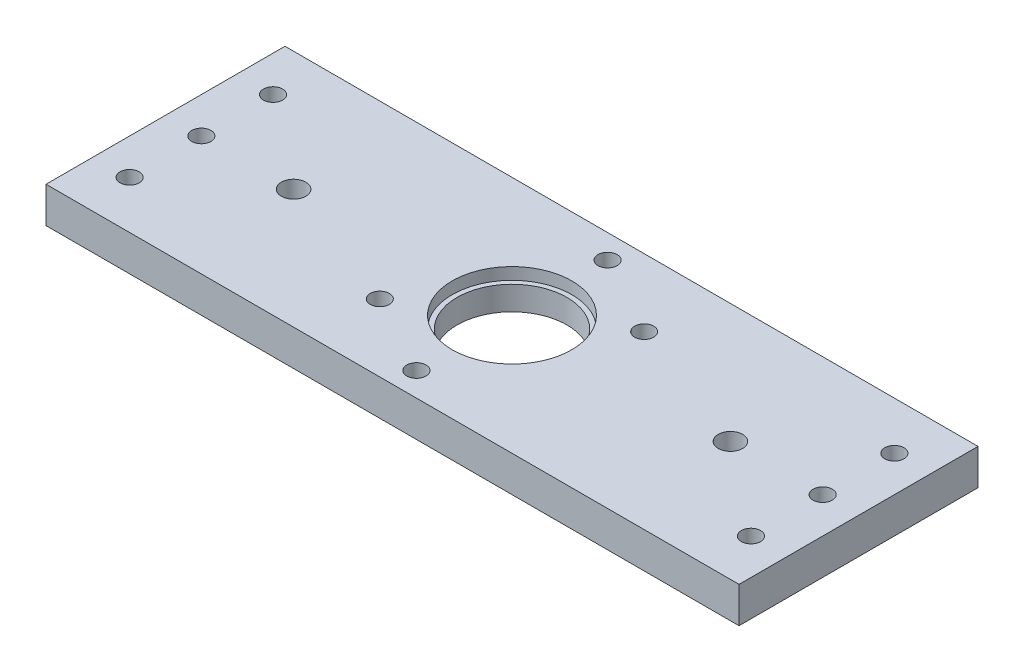
from build123d import *

# Parameters (mm, degrees)
SKETCH1_W                  = 184.15
SKETCH1_H                  = 63.5
BOSS_EXTRUDE1_DEPTH        = 9.525
SKETCH3_R                  = 14.605
CUT_EXTRUDE1_DEPTH         = 98.860072297
F_10_CLEARANCE_HOLE1_D     = 5.1054
F_6_5_6_5_DIAMETER_HOLE3_D = 6.5
SKETCH29_R                 = 15.875
CUT_EXTRUDE5_DEPTH         = 3.175
F_10_CLEARANCE_HOLE2_D     = 5.1054
SKETCH36_R                 = 2.54
CUT_EXTRUDE6_DEPTH         = 98.860072297


with BuildPart() as part:
    # Sketch1 → Boss-Extrude1 (new body)
    with BuildSketch(Plane(origin=(0, 0, 0), x_dir=(1, 0, 0), z_dir=(0, 1, 0))):
        Rectangle(SKETCH1_W, SKETCH1_H)
    extrude(amount=BOSS_EXTRUDE1_DEPTH)

    # Sketch3 → Cut-Extrude1 (cut, through all)
    with BuildSketch(Plane(origin=(0, 9.525, 0), x_dir=(1, 0, 0), z_dir=(0, 1, 0))):
        with Locations(Location((0, 0, 0), (0, 0, 270))):
            Circle(SKETCH3_R)
    extrude(amount=-CUT_EXTRUDE1_DEPTH, mode=Mode.SUBTRACT)

    # #10 Clearance Hole1 (through all)
    with Locations(Plane(origin=(0, 0, 0), x_dir=(-1, 0, 0), z_dir=(0, -1, 0))):
        with Locations((0, -25.4), (0, 25.4)):
            Hole(F_10_CLEARANCE_HOLE1_D / 2)

    # Ø6.5 (6.5) Diameter Hole3 (through all)
    with Locations(Plane(origin=(0, 0, 0), x_dir=(-1, 0, 0), z_dir=(0, -1, 0))):
        with Locations((58.039, 0), (-58.039, 0)):
            Hole(F_6_5_6_5_DIAMETER_HOLE3_D / 2)

    # Sketch29 → Cut-Extrude5 (cut)
    with BuildSketch(Plane(origin=(0, 9.525, 0), x_dir=(1, 0, 0), z_dir=(0, 1, 0))):
        with Locations(Location((0, 0, 0), (0, 0, 270))):
            Circle(SKETCH29_R)
    extrude(amount=-CUT_EXTRUDE5_DEPTH, mode=Mode.SUBTRACT)

    # #10 Clearance Hole2 (through all)
    with Locations(Plane(origin=(0, 9.525, 0), x_dir=(1, 0, 0), z_dir=(0, 1, 0))):
        with Locations((-82.55, 19.05), (-82.55, -19.05), (82.55, -19.05), (82.55, 19.05), (-82.55, 0), (82.55, 0)):
            Hole(F_10_CLEARANCE_HOLE2_D / 2)

    # Sketch36 → Cut-Extrude6 (cut, through all)
    with BuildSketch(Plane.XZ):
        with Locations(Location((-21.329210467, 13.7922, 0), (0, 0, 270))):
            Circle(SKETCH36_R)
        with Locations(Location((21.329210467, -13.7922, 0), (0, 0, 270))):
            Circle(SKETCH36_R)
    extrude(amount=-CUT_EXTRUDE6_DEPTH, mode=Mode.SUBTRACT)


solid = part.part
